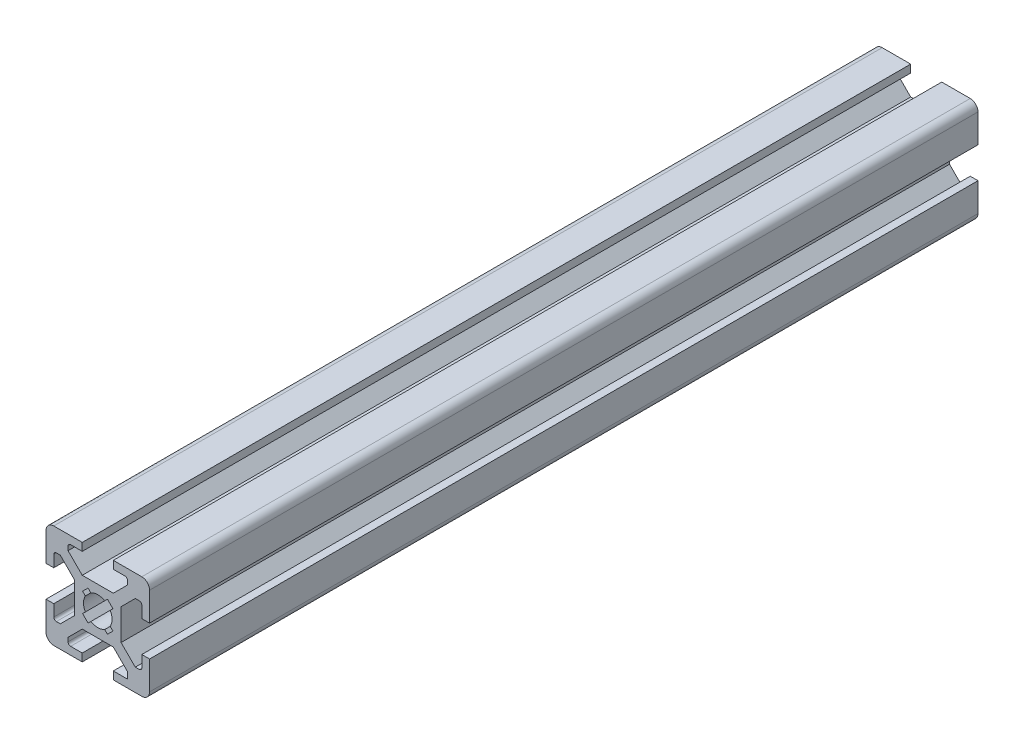
from build123d import *

# Parameters (mm, degrees)
SALIENTE_EXTRUIR1_DEPTH = 160
REDONDEO1_R             = 1.5
REDONDEO2_R             = 0.5
CORTAR_EXTRUIR1_DEPTH   = 161.623784042


with BuildPart() as part:
    # Croquis1 → Saliente-Extruir1 (new body)
    with BuildSketch(Plane.XY):
        Polygon((3, -4.5), (5.7413765, -7.2413765), (5.7413765, -8.5), (3, -8.5), (3, -10), (10, -10), (10, -3), (8.5, -3), (8.5, -5.7413765), (7.2413765, -5.7413765), (4.5, -3), (4.5, 3), (7.2413765, 5.7413765), (8.5, 5.7413765), (8.5, 3), (10, 3), (10, 10), (3, 10), (3, 8.5), (5.7413765, 8.5), (5.7413765, 7.2413765), (3, 4.5), (-3, 4.5), (-5.7413765, 7.2413765), (-5.7413765, 8.5), (-3, 8.5), (-3, 10), (-10, 10), (-10, 3), (-8.5, 3), (-8.5, 5.7413765), (-7.2413765, 5.7413765), (-4.5, 3), (-4.5, -3), (-7.2413765, -5.7413765), (-8.5, -5.7413765), (-8.5, -3), (-10, -3), (-10, -10), (-3, -10), (-3, -8.5), (-5.7413765, -8.5), (-5.7413765, -7.2413765), (-3, -4.5), align=None)
    extrude(amount=SALIENTE_EXTRUIR1_DEPTH)

    # Redondeo1
    redondeo1_edges = [part.edges().sort_by_distance(p)[0] for p in [
        (10, -10, 80),
        (-10, -10, 80),
        (-10, 10, 80),
        (10, 10, 80),
    ]]
    fillet(redondeo1_edges, radius=REDONDEO1_R)

    # Redondeo2
    redondeo2_edges = [part.edges().sort_by_distance(p)[0] for p in [
        (-5.7413765, -8.5, 80),
        (-8.5, -5.7413765, 80),
        (-8.5, 5.7413765, 80),
        (-5.7413765, 8.5, 80),
        (5.7413765, 8.5, 80),
        (8.5, 5.7413765, 80),
        (8.5, -5.7413765, 80),
    ]]
    fillet(redondeo2_edges, radius=REDONDEO2_R)

    # Croquis2 → Cortar-Extruir1 (cut, through all)
    with BuildSketch(Plane(origin=(0, 0, 0), x_dir=(-1, 0, 0), z_dir=(0, 0, -1))):
        with BuildLine():
            Line((-1.340498607, 2.401158779), (-1.870828693, 2.931488865))
            Line((-1.870828693, 2.931488865), (-2.931488865, 1.870828693))
            Line((-2.931488865, 1.870828693), (-2.401158779, 1.340498607))
            ThreePointArc((-2.401158779, 1.340498607), (-2.75, 0), (-2.401158779, -1.340498607))
            Line((-2.401158779, -1.340498607), (-2.931488865, -1.870828693))
            Line((-2.931488865, -1.870828693), (-1.870828693, -2.931488865))
            Line((-1.870828693, -2.931488865), (-1.340498607, -2.401158779))
            ThreePointArc((-1.340498607, -2.401158779), (0, -2.75), (1.340498607, -2.401158779))
            Line((1.340498607, -2.401158779), (1.870828693, -2.931488865))
            Line((1.870828693, -2.931488865), (2.931488865, -1.870828693))
            Line((2.931488865, -1.870828693), (2.401158779, -1.340498607))
            ThreePointArc((2.401158779, -1.340498607), (2.75, 0), (2.401158779, 1.340498607))
            Line((2.401158779, 1.340498607), (2.931488865, 1.870828693))
            Line((2.931488865, 1.870828693), (1.870828693, 2.931488865))
            Line((1.870828693, 2.931488865), (1.340498607, 2.401158779))
            ThreePointArc((1.340498607, 2.401158779), (0, 2.75), (-1.340498607, 2.401158779))
        make_face()
    extrude(amount=-CORTAR_EXTRUIR1_DEPTH, mode=Mode.SUBTRACT)


solid = part.part
